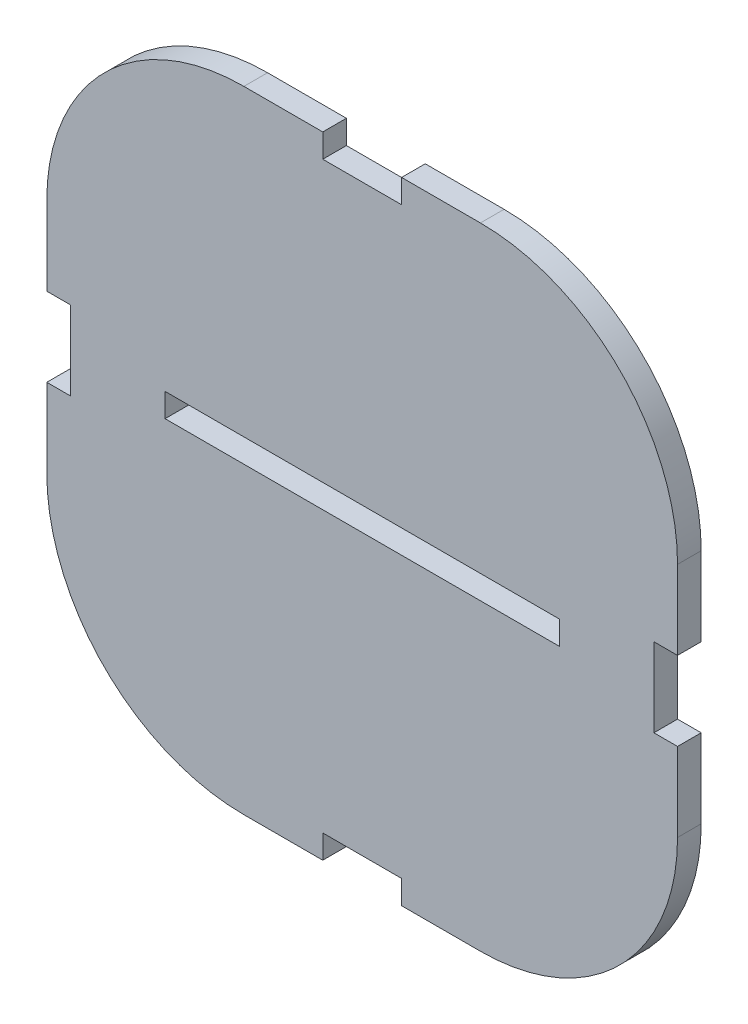
from build123d import *

# Parameters (mm, degrees)
SKETCH_1_W      = 50
SKETCH_1_H      = 3
EXTRUDE_1_DEPTH = 3


with BuildPart() as part:
    # 草圖1 → 填料-伸長1 (new body)
    with BuildSketch(Plane.XY):
        with BuildLine():
            Line((-5, 40), (-15, 40))
            ThreePointArc((-15, 40), (-32.67766953, 32.67766953), (-40, 15))
            Line((-40, 15), (-40, 5))
            Line((-40, 5), (-37, 5))
            Line((-37, 5), (-37, -5))
            Line((-37, -5), (-40, -5))
            Line((-40, -5), (-40, -15))
            ThreePointArc((-40, -15), (-32.67766953, -32.67766953), (-15, -40))
            Line((-15, -40), (-5, -40))
            Line((-5, -40), (-5, -37))
            Line((-5, -37), (5, -37))
            Line((5, -37), (5, -40))
            Line((5, -40), (15, -40))
            ThreePointArc((15, -40), (32.67766953, -32.67766953), (40, -15))
            Line((40, -15), (40, -5))
            Line((40, -5), (37, -5))
            Line((37, -5), (37, 5))
            Line((37, 5), (40, 5))
            Line((40, 5), (40, 15))
            ThreePointArc((40, 15), (32.67766953, 32.67766953), (15, 40))
            Line((15, 40), (5, 40))
            Line((5, 40), (5, 37))
            Line((5, 37), (-5, 37))
            Line((-5, 37), (-5, 40))
        make_face()
        Rectangle(SKETCH_1_W, SKETCH_1_H, mode=Mode.SUBTRACT)
    extrude(amount=EXTRUDE_1_DEPTH)


solid = part.part
